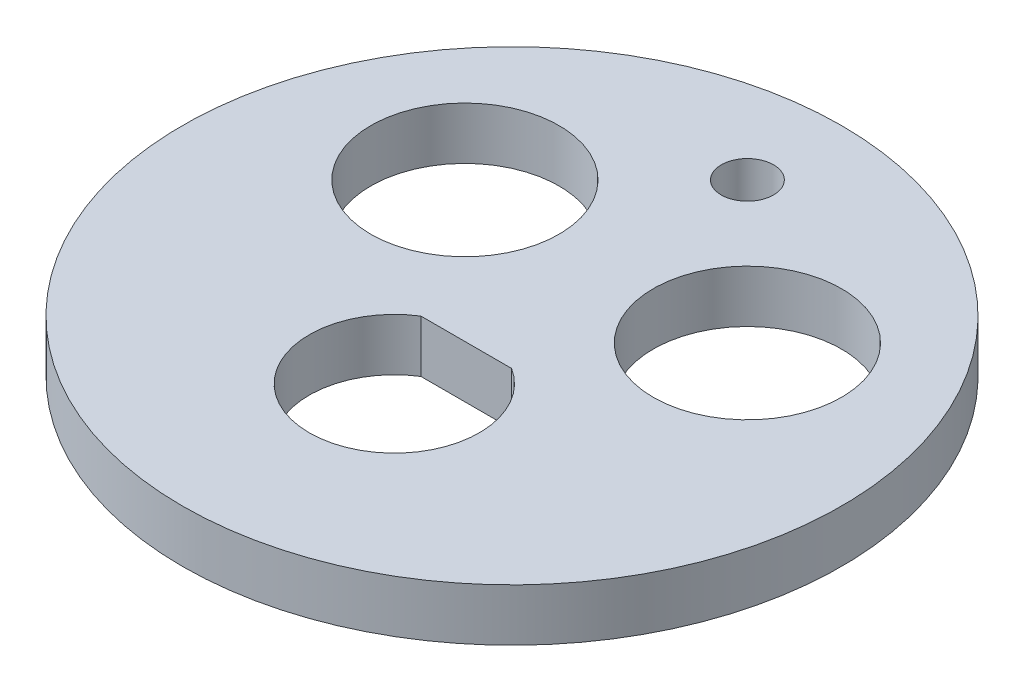
from build123d import *

# Parameters (mm, degrees)
SKETCH1_W                                     = 12.6
SKETCH1_H                                     = 2
FOUR_THROUGH_HOLES_BOTH_DIRECTIONS_DEPTH      = 18.93097878
FOUR_THROUGH_HOLES_BOTH_DIRECTIONS_DEPTH_BACK = 18.93097878
SMA_D6_5_HOSES_D7_2_VENT_D2_R                 = 3.6
SMA_D6_5_HOSES_D7_2_VENT_D2_R_2               = 1


with BuildPart() as part:
    # Sketch1 → Revolve1 (revolve)
    with BuildSketch(Plane.XY, mode=Mode.PRIVATE) as revolve1_sk:
        with Locations((6.3, 1)):
            Rectangle(SKETCH1_W, SKETCH1_H)
    revolve(revolve1_sk.sketch.rotate(Axis((0, -200, 0), (0, 1, 0)), 90), axis=Axis((0, -200, 0), (0, 1, 0)))

    # SMA D6.5 - hoses D7.2 - vent D2 → Four through holes - both directions (cut, two sides: drawn at the far end of the back side and taken through both)
    with BuildSketch(Plane(origin=(0, 0, 0), x_dir=(1, 0, 0), z_dir=(0, 1, 0)).offset(-FOUR_THROUGH_HOLES_BOTH_DIRECTIONS_DEPTH_BACK)):
        with Locations(Location((-5.4, 3.6, 0), (0, 0, 270))):
            Circle(SMA_D6_5_HOSES_D7_2_VENT_D2_R)
        with Locations(Location((5.4, 3.6, 0), (0, 0, 270))):
            Circle(SMA_D6_5_HOSES_D7_2_VENT_D2_R)
        with Locations(Location((0, 9, 0), (0, 0, 270))):
            Circle(SMA_D6_5_HOSES_D7_2_VENT_D2_R_2)
        with BuildLine():
            Line((-1.732050808, -1.75), (1.732050808, -1.75))
            ThreePointArc((1.732050808, -1.75), (0, -7.75), (-1.732050808, -1.75))
        make_face()
    extrude(amount=FOUR_THROUGH_HOLES_BOTH_DIRECTIONS_DEPTH + FOUR_THROUGH_HOLES_BOTH_DIRECTIONS_DEPTH_BACK, mode=Mode.SUBTRACT)


solid = part.part
